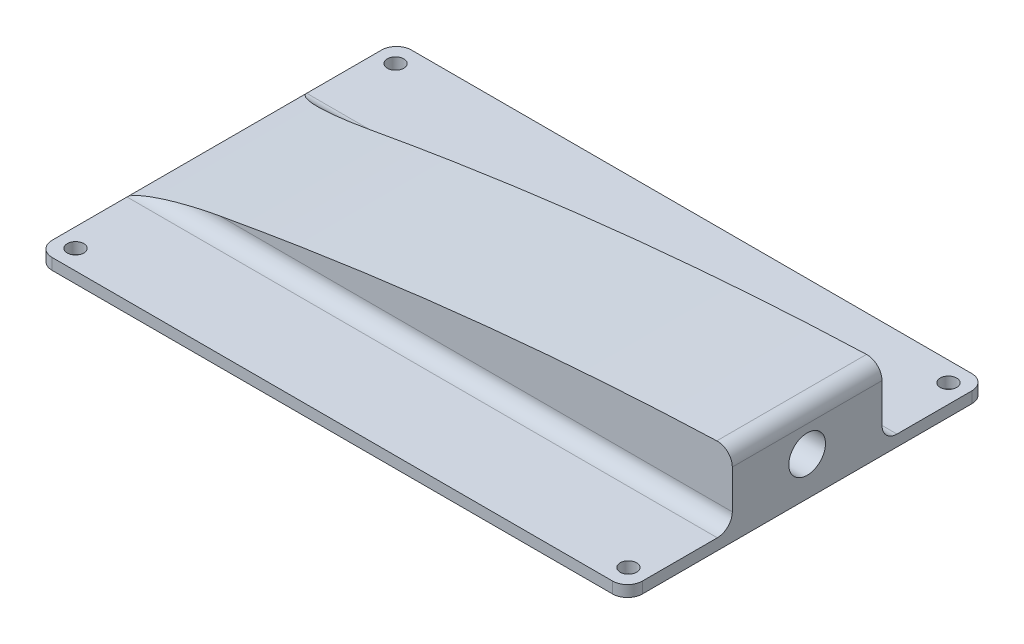
from build123d import *

# Parameters (mm, degrees)
SKETCH1_W                = 78.86
SKETCH1_H                = 48
BOSS_EXTRUDE1_DEPTH      = 1.5
CUT_EXTRUDE1_REACH       = 48.184
SKETCH2_R                = 1.1
FILLET1_R                = 2
BOSS_EXTRUDE2_DEPTH      = 10
BOSS_EXTRUDE2_DEPTH_BACK = 10
FILLET3_R                = 2
FILLET5_R                = 2
SKETCH4_R                = 2.45
CUT_EXTRUDE2_DEPTH       = 20


with BuildPart() as part:
    # Sketch1 → Boss-Extrude1 (new body)
    with BuildSketch(Plane(origin=(0, 0, 0), x_dir=(1, 0, 0), z_dir=(0, 1, 0))):
        Rectangle(SKETCH1_W, SKETCH1_H)
    extrude(amount=BOSS_EXTRUDE1_DEPTH)

    # Sketch2 → Cut-Extrude1 (cut, up to next)
    with BuildSketch(Plane(origin=(0, 1.5, 0), x_dir=(1, 0, 0), z_dir=(0, 1, 0)), mode=Mode.PRIVATE) as cut_extrude1_sk1:
        with Locations(Location((-36.93, 21.375, 0), (0, 0, 270))):
            Circle(SKETCH2_R)
    cut_extrude1_tool1 = extrude(cut_extrude1_sk1.sketch, amount=-CUT_EXTRUDE1_REACH, mode=Mode.PRIVATE) & part.part
    # Sketch2 → Cut-Extrude1 (cut, up to next)
    with BuildSketch(Plane(origin=(0, 1.5, 0), x_dir=(1, 0, 0), z_dir=(0, 1, 0)), mode=Mode.PRIVATE) as cut_extrude1_sk2:
        with Locations(Location((-36.93, -21.375, 0), (0, 0, 270))):
            Circle(SKETCH2_R)
    cut_extrude1_tool2 = extrude(cut_extrude1_sk2.sketch, amount=-CUT_EXTRUDE1_REACH, mode=Mode.PRIVATE) & part.part
    # Sketch2 → Cut-Extrude1 (cut, up to next)
    with BuildSketch(Plane(origin=(0, 1.5, 0), x_dir=(1, 0, 0), z_dir=(0, 1, 0)), mode=Mode.PRIVATE) as cut_extrude1_sk3:
        with Locations(Location((36.93, 21.375, 0), (0, 0, 270))):
            Circle(SKETCH2_R)
    cut_extrude1_tool3 = extrude(cut_extrude1_sk3.sketch, amount=-CUT_EXTRUDE1_REACH, mode=Mode.PRIVATE) & part.part
    # Sketch2 → Cut-Extrude1 (cut, up to next)
    with BuildSketch(Plane(origin=(0, 1.5, 0), x_dir=(1, 0, 0), z_dir=(0, 1, 0)), mode=Mode.PRIVATE) as cut_extrude1_sk4:
        with Locations(Location((36.93, -21.375, 0), (0, 0, 270))):
            Circle(SKETCH2_R)
    cut_extrude1_tool4 = extrude(cut_extrude1_sk4.sketch, amount=-CUT_EXTRUDE1_REACH, mode=Mode.PRIVATE) & part.part
    add(cut_extrude1_tool1.solids().sort_by_distance((-36.93, 1.5, -21.375))[0], mode=Mode.SUBTRACT)
    add(cut_extrude1_tool2.solids().sort_by_distance((-36.93, 1.5, 21.375))[0], mode=Mode.SUBTRACT)
    add(cut_extrude1_tool3.solids().sort_by_distance((36.93, 1.5, -21.375))[0], mode=Mode.SUBTRACT)
    add(cut_extrude1_tool4.solids().sort_by_distance((36.93, 1.5, 21.375))[0], mode=Mode.SUBTRACT)

    # Fillet1
    fillet1_edges = [part.edges().sort_by_distance(p)[0] for p in [
        (-39.43, 0.75, -24),
        (39.43, 0.75, -24),
        (39.43, 0.75, 24),
        (-39.43, 0.75, 24),
    ]]
    fillet(fillet1_edges, radius=FILLET1_R)

    # Sketch3 → Boss-Extrude2 (add, two sides: drawn at the far end of the back side and taken through both)
    with BuildSketch(Plane.XY.offset(-BOSS_EXTRUDE2_DEPTH_BACK)):
        with BuildLine():
            Line((39.43, 0.75), (39.43, 10.75))
            add(Edge.make_bspline(
                [(-39.43, 1.5), (-0.251175804, 9.517193524), (39.43, 10.75)],
                knots=[0, 0, 0, 1, 1, 1], degree=2))
            Line((-39.43, 1.5), (-39.43, 0.75))
            Line((-39.43, 0.75), (39.43, 0.75))
        make_face()
    extrude(amount=BOSS_EXTRUDE2_DEPTH + BOSS_EXTRUDE2_DEPTH_BACK)

    # Fillet3
    fillet3_edges = [part.edges().sort_by_distance(p)[0] for p in [
        (0, 1.5, 10),
        (0, 1.5, -10),
    ]]
    fillet(fillet3_edges, radius=FILLET3_R)

    # Fillet5
    fillet5_edges = [part.edges().sort_by_distance(p)[0] for p in [
        (39.43, 10.75, -5),
    ]]
    fillet(fillet5_edges, radius=FILLET5_R)

    # Sketch4 → Cut-Extrude2 (cut)
    with BuildSketch(Plane(origin=(39.43, 0, 0), x_dir=(0, 0, -1), z_dir=(1, 0, 0))):
        with Locations((0, 5.182287096)):
            Circle(SKETCH4_R)
    extrude(amount=-CUT_EXTRUDE2_DEPTH, mode=Mode.SUBTRACT)


solid = part.part
